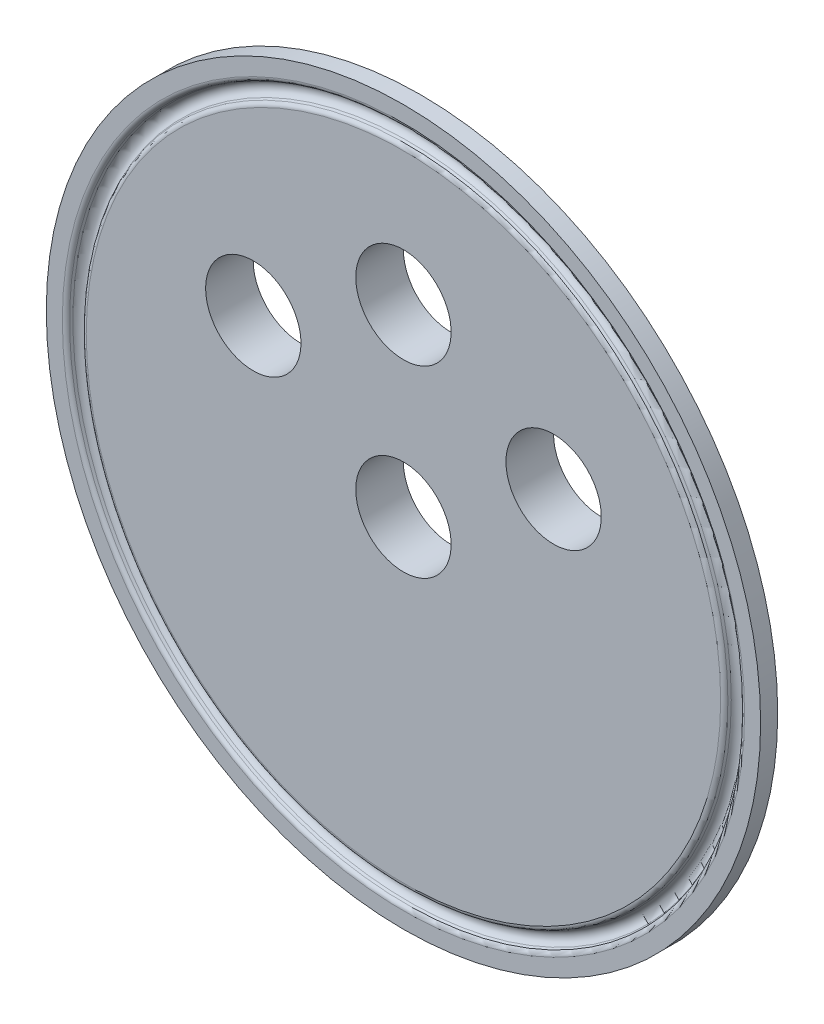
from build123d import *

# Parameters (mm, degrees)
SKETCH2_R          = 7.9375
CUT_EXTRUDE1_DEPTH = 85.463711951


with BuildPart() as part:
    # Sketch1 → Revolve1 (revolve)
    with BuildSketch(Plane(origin=(0, 0, 0), x_dir=(0, 0, -1), z_dir=(1, 0, 0)), mode=Mode.PRIVATE) as revolve1_sk:
        with BuildLine():
            Line((0, 0), (0, 52.809927725))
            ThreePointArc((0, 52.809927725), (0.130798304, 53.244522907), (0.479738309, 53.534733247))
            Line((0.479738309, 53.534733247), (0.872854821, 53.701601306))
            ThreePointArc((0.872854821, 53.701601306), (1.6002, 54.8005), (0.872854821, 55.899398694))
            Line((0.872854821, 55.899398694), (0.479738309, 56.066266753))
            ThreePointArc((0.479738309, 56.066266753), (0.130798304, 56.356477093), (0, 56.791072275))
            Line((0, 56.791072275), (0, 59.4614))
            Line((0, 59.4614), (2.8448, 59.4614))
            Line((2.8448, 59.4614), (7.9248, 45.504214709))
            Line((7.9248, 45.504214709), (7.9248, 0))
            Line((7.9248, 0), (0, 0))
        make_face()
    revolve(revolve1_sk.sketch.rotate(Axis((0, 0, 0), (0, 0, -1)), 90), axis=Axis((0, 0, 0), (0, 0, -1)))

    # Sketch2 → Cut-Extrude1 (cut, through all)
    with BuildSketch(Plane(origin=(0, 0, -7.9248), x_dir=(-1, 0, 0), z_dir=(0, 0, -1))):
        with Locations((-25, 16.5)):
            Circle(SKETCH2_R)
        with Locations((0, 30.6)):
            Circle(SKETCH2_R)
        with Locations((25, 16.5)):
            Circle(SKETCH2_R)
        Circle(SKETCH2_R)
    extrude(amount=-CUT_EXTRUDE1_DEPTH, mode=Mode.SUBTRACT)


solid = part.part
